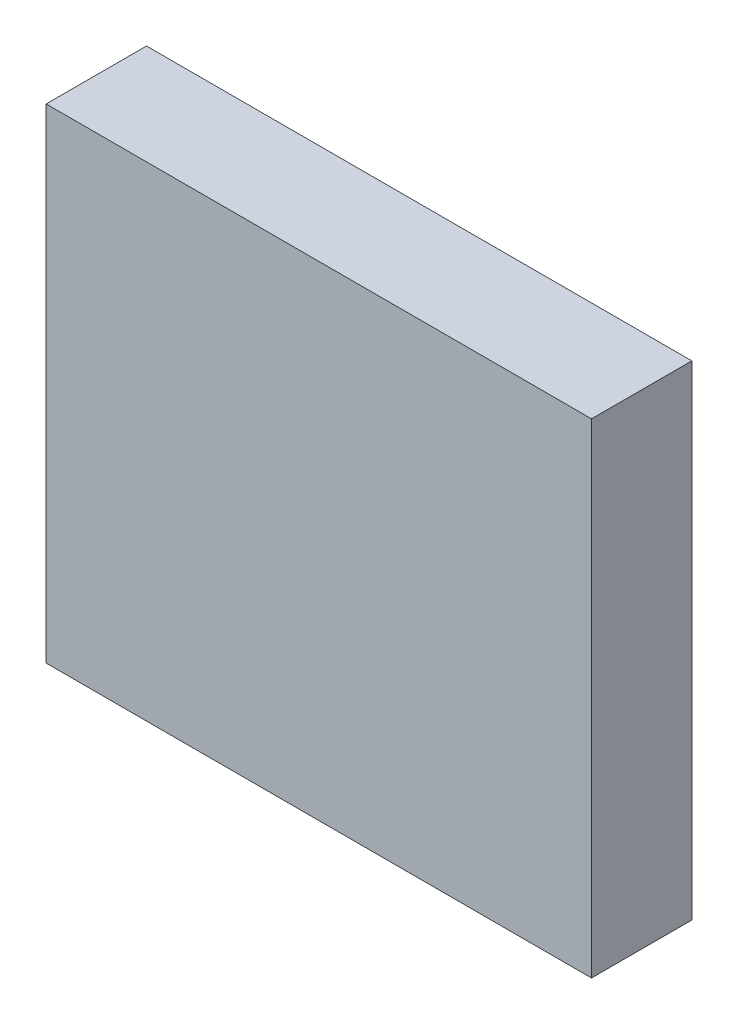
from build123d import *

# Parameters (mm, degrees)
SKETCH_1_W          = 90
SKETCH_1_H          = 90
EXTRUDE_1_DEPTH     = 1.6
SKETCH_4_W          = 17.78
SKETCH_4_H          = 8.5
SKETCH_4_W_2        = 2.5
SKETCH_4_H_2        = 17.78
SKETCH_4_W_3        = 8.5
EXTRUDE_2_DEPTH     = 2.5
SKETCH_5_W          = 0.64
SKETCH_5_H          = 0.64
EXTRUDE_3_DEPTH     = 6.1
SKETCH_6_W          = 3.48
SKETCH_6_H          = 3.48
EXTRUDE_4_DEPTH     = 2
SKETCH_7_W          = 2
SKETCH_7_H          = 4
SKETCH_7_W_2        = 4
SKETCH_7_H_2        = 2
EXTRUDE_5_DEPTH     = 1.1
SKETCH_8_W          = 7.4
SKETCH_8_H          = 15.2
EXTRUDE_6_DEPTH     = 2.65
SKETCH_9_W          = 0.64
SKETCH_9_H          = 0.64
CUT_EXTRUDE_1_DEPTH = 7.5
SKETCH_10_W         = 0.64
SKETCH_10_H         = 0.64
CUT_EXTRUDE_2_DEPTH = 7.5
SKETCH_11_W         = 0.64
SKETCH_11_H         = 0.64
CUT_EXTRUDE_3_DEPTH = 7.5
SKETCH_14_W         = 101.35
SKETCH_14_H         = 90
EXTRUDE_9_DEPTH     = 18.65


with BuildPart() as part:
    # ｽｹｯﾁ1 → ﾎﾞｽ - 押し出し1 (new body)
    with BuildSketch(Plane.XY):
        Rectangle(SKETCH_1_W, SKETCH_1_H)
    extrude(amount=EXTRUDE_1_DEPTH)

    # ｽｹｯﾁ4 → ﾎﾞｽ - 押し出し2 (add)
    with BuildSketch(Plane(origin=(0, 0, 0), x_dir=(-1, 0, 0), z_dir=(0, 0, -1))):
        with Locations((-15, -40.35)):
            Rectangle(SKETCH_4_W, SKETCH_4_H)
        with Locations((-37.6, 18)):
            Rectangle(SKETCH_4_W_2, SKETCH_4_H_2)
        with Locations((25, 40.35)):
            Rectangle(SKETCH_4_W, SKETCH_4_H)
        with Locations((40.35, 18)):
            Rectangle(SKETCH_4_W_3, SKETCH_4_H_2)
    extrude(amount=EXTRUDE_2_DEPTH)

    # ｽｹｯﾁ5 → ﾎﾞｽ - 押し出し3 (add)
    with BuildSketch(Plane(origin=(0, 0, -2.5), x_dir=(-1, 0, 0), z_dir=(0, 0, -1))):
        with Locations((-37.6, 18)):
            Rectangle(SKETCH_5_W, SKETCH_5_H)
        with Locations((-37.6, 15.46)):
            Rectangle(SKETCH_5_W, SKETCH_5_H)
        with Locations((-37.6, 12.92)):
            Rectangle(SKETCH_5_W, SKETCH_5_H)
        with Locations((-37.6, 10.38)):
            Rectangle(SKETCH_5_W, SKETCH_5_H)
        with Locations((-37.6, 20.54)):
            Rectangle(SKETCH_5_W, SKETCH_5_H)
        with Locations((-37.6, 23.08)):
            Rectangle(SKETCH_5_W, SKETCH_5_H)
        with Locations((-37.6, 25.62)):
            Rectangle(SKETCH_5_W, SKETCH_5_H)
    extrude(amount=EXTRUDE_3_DEPTH)

    # ｽｹｯﾁ6 → ﾎﾞｽ - 押し出し4 (add)
    with BuildSketch(Plane.XY.offset(1.6)):
        with Locations((-40, -35)):
            Rectangle(SKETCH_6_W, SKETCH_6_H)
        with Locations((-40, 35)):
            Rectangle(SKETCH_6_W, SKETCH_6_H)
        with Locations((30, -35)):
            Rectangle(SKETCH_6_W, SKETCH_6_H)
        with Locations((30, 35)):
            Rectangle(SKETCH_6_W, SKETCH_6_H)
    extrude(amount=EXTRUDE_4_DEPTH)

    # ｽｹｯﾁ7 → ﾎﾞｽ - 押し出し5 (add)
    with BuildSketch(Plane.XY.offset(1.6)):
        with Locations((-40, 0)):
            Rectangle(SKETCH_7_W, SKETCH_7_H)
        with Locations((30, 0)):
            Rectangle(SKETCH_7_W, SKETCH_7_H)
        with Locations((-5, 35)):
            Rectangle(SKETCH_7_W_2, SKETCH_7_H_2)
        with Locations((-5, -35)):
            Rectangle(SKETCH_7_W_2, SKETCH_7_H_2)
        with Locations((-5, 0)):
            Rectangle(SKETCH_7_W, SKETCH_7_H)
    extrude(amount=EXTRUDE_5_DEPTH)

    # ｽｹｯﾁ8 → ﾎﾞｽ - 押し出し6 (add)
    with BuildSketch(Plane.XY.offset(1.6)):
        with Locations((11, 0)):
            Rectangle(SKETCH_8_W, SKETCH_8_H)
    extrude(amount=EXTRUDE_6_DEPTH)

    # ｽｹｯﾁ9 → ｶｯﾄ - 押し出し1 (cut)
    with BuildSketch(Plane.XZ.offset(44.6)):
        with Locations((15, -1.25)):
            Rectangle(SKETCH_9_W, SKETCH_9_H)
        with Locations((12.46, -1.25)):
            Rectangle(SKETCH_9_W, SKETCH_9_H)
        with Locations((9.92, -1.25)):
            Rectangle(SKETCH_9_W, SKETCH_9_H)
        with Locations((7.38, -1.25)):
            Rectangle(SKETCH_9_W, SKETCH_9_H)
        with Locations((17.54, -1.25)):
            Rectangle(SKETCH_9_W, SKETCH_9_H)
        with Locations((20.08, -1.25)):
            Rectangle(SKETCH_9_W, SKETCH_9_H)
        with Locations((22.62, -1.25)):
            Rectangle(SKETCH_9_W, SKETCH_9_H)
    extrude(amount=-CUT_EXTRUDE_1_DEPTH, mode=Mode.SUBTRACT)

    # ｽｹｯﾁ10 → ｶｯﾄ - 押し出し2 (cut)
    with BuildSketch(Plane.ZY.offset(44.6)):
        with Locations((-1.25, 18)):
            Rectangle(SKETCH_10_W, SKETCH_10_H)
        with Locations((-1.25, 25.62)):
            Rectangle(SKETCH_10_W, SKETCH_10_H)
        with Locations((-1.25, 23.08)):
            Rectangle(SKETCH_10_W, SKETCH_10_H)
        with Locations((-1.25, 20.54)):
            Rectangle(SKETCH_10_W, SKETCH_10_H)
        with Locations((-1.25, 15.46)):
            Rectangle(SKETCH_10_W, SKETCH_10_H)
        with Locations((-1.25, 12.92)):
            Rectangle(SKETCH_10_W, SKETCH_10_H)
        with Locations((-1.25, 10.38)):
            Rectangle(SKETCH_10_W, SKETCH_10_H)
    extrude(amount=-CUT_EXTRUDE_2_DEPTH, mode=Mode.SUBTRACT)

    # ｽｹｯﾁ11 → ｶｯﾄ - 押し出し3 (cut)
    with BuildSketch(Plane(origin=(0, 44.6, 0), x_dir=(1, 0, 0), z_dir=(0, 1, 0))):
        with Locations((-25, 1.25)):
            Rectangle(SKETCH_11_W, SKETCH_11_H)
        with Locations((-32.62, 1.25)):
            Rectangle(SKETCH_11_W, SKETCH_11_H)
        with Locations((-30.08, 1.25)):
            Rectangle(SKETCH_11_W, SKETCH_11_H)
        with Locations((-27.54, 1.25)):
            Rectangle(SKETCH_11_W, SKETCH_11_H)
        with Locations((-22.46, 1.25)):
            Rectangle(SKETCH_11_W, SKETCH_11_H)
        with Locations((-19.92, 1.25)):
            Rectangle(SKETCH_11_W, SKETCH_11_H)
        with Locations((-17.38, 1.25)):
            Rectangle(SKETCH_11_W, SKETCH_11_H)
    extrude(amount=-CUT_EXTRUDE_3_DEPTH, mode=Mode.SUBTRACT)


with BuildPart() as body_2:
    # ｽｹｯﾁ14 → ﾎﾞｽ - 押し出し9 (new body)
    with BuildSketch(Plane(origin=(0, 0, -2.5), x_dir=(-1, 0, 0), z_dir=(0, 0, -1))):
        with Locations((-4.325, 0)):
            Rectangle(SKETCH_14_W, SKETCH_14_H)
    extrude(amount=-EXTRUDE_9_DEPTH)


solid = Compound([part.part, body_2.part])
